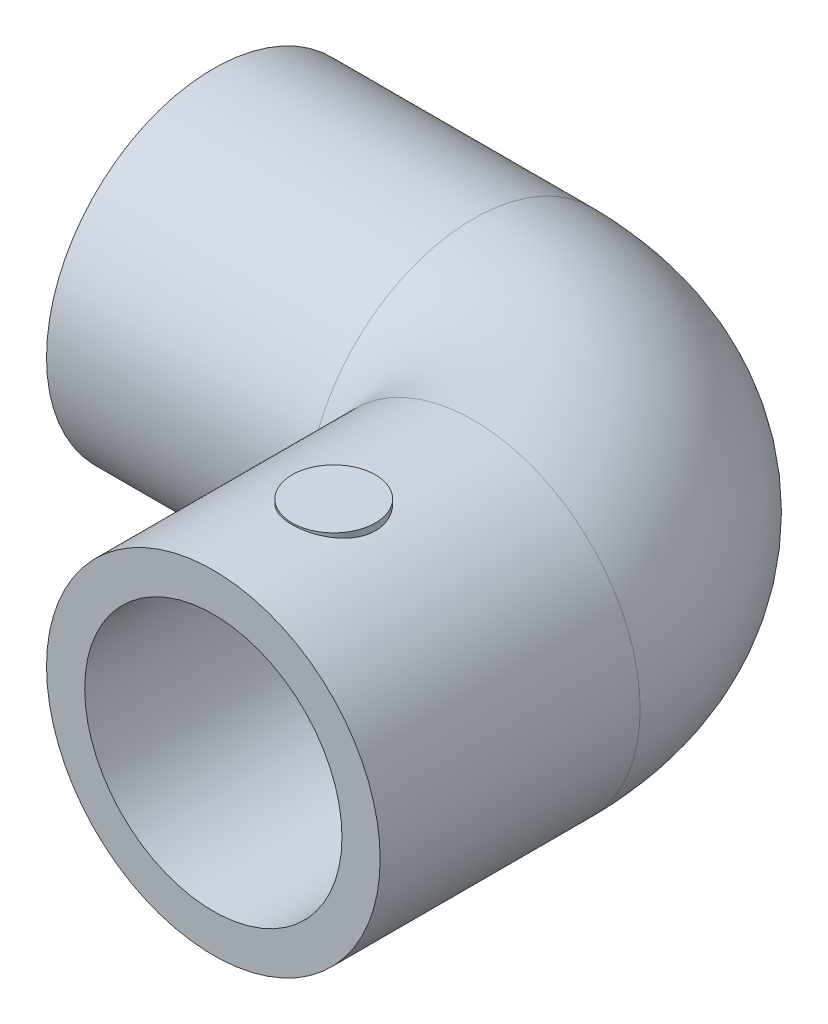
from build123d import *

# Parameters (mm, degrees)
CROQUIS2_R              = 13.875
CROQUIS2_R_2            = 10.7
SALIENTE_EXTRUIR1_START = -22.5
CROQUIS3_R              = 10.7
CROQUIS3_R_2            = 10.003405024
SALIENTE_EXTRUIR1_DEPTH = 1
SALIENTE_EXTRUIR2_START = -22.5
CROQUIS5_R              = 10.7
CROQUIS5_R_2            = 9.69715728
SALIENTE_EXTRUIR2_DEPTH = 1
SALIENTE_EXTRUIR3_START = 14
CROQUIS6_R              = 3.466635683
SALIENTE_EXTRUIR3_DEPTH = 1


with BuildPart() as part:
    # Barrer1: sweep along a path in Croquis1
    with BuildLine(Plane(origin=(0, 0, 0), x_dir=(1, 0, 0), z_dir=(0, 1, 0))) as barrer1_path:
        Line((-36.125, 0), (-14.5, 0))
        ThreePointArc((-14.5, 0), (-4.246951673, -4.246951673), (0, -14.5))
        Line((0, -14.5), (0, -36.125))
    # Croquis2 → Barrer1 (sweep)
    with BuildSketch(Plane.XY.offset(36.125)):
        Circle(CROQUIS2_R)
        Circle(CROQUIS2_R_2, mode=Mode.SUBTRACT)
    sweep(path=barrer1_path.line)

    # Croquis3 → Saliente-Extruir1 (add)
    with BuildSketch(Plane.XY.offset(36.125).offset(SALIENTE_EXTRUIR1_START)):
        Circle(CROQUIS3_R)
        Circle(CROQUIS3_R_2, mode=Mode.SUBTRACT)
    extrude(amount=-SALIENTE_EXTRUIR1_DEPTH)

    # Croquis5 → Saliente-Extruir2 (add)
    with BuildSketch(Plane.ZY.offset(36.125).offset(SALIENTE_EXTRUIR2_START)):
        with Locations(Location((0, 0, 0), (0, 0, 180))):
            Circle(CROQUIS5_R)
        Circle(CROQUIS5_R_2, mode=Mode.SUBTRACT)
    extrude(amount=SALIENTE_EXTRUIR2_DEPTH)

    # Croquis6 → Saliente-Extruir3 (add)
    with BuildSketch(Plane(origin=(0, 0, 0), x_dir=(1, 0, 0), z_dir=(0, 1, 0)).offset(SALIENTE_EXTRUIR3_START)):
        with Locations(Location((0, -26.109260765, 0), (0, 0, 270))):
            Circle(CROQUIS6_R)
    extrude(amount=-SALIENTE_EXTRUIR3_DEPTH)


solid = part.part
